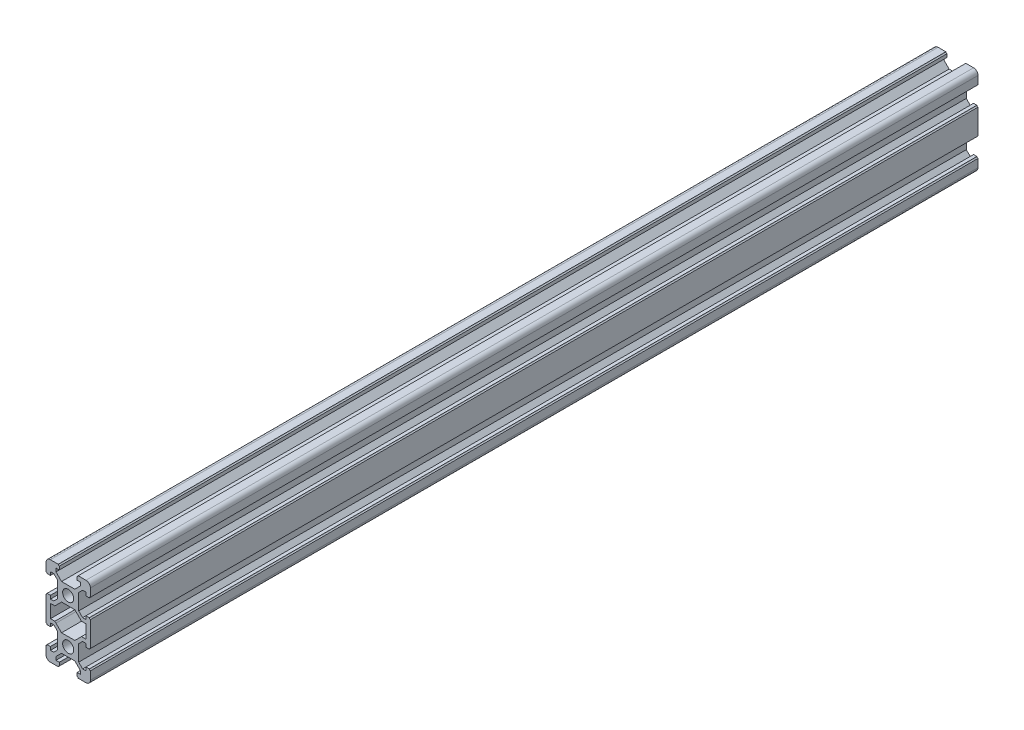
from build123d import *
from build123d.topology import SkipClean

# Parameters (mm, degrees)
EXTRUDE_1_DEPTH       = 200
MIRROR_2_COPY_1_DEPTH = 200
MIRROR_2_COPY_2_DEPTH = 200
FILLET_1_R            = 2


with BuildPart() as part:
    # Эскиз1 → Бобышка-Вытянуть1 (new, symmetric)
    with BuildSketch(Plane.XY):
        with BuildLine():
            Line((3, 14), (0, 14))
            Line((0, 14), (0, 12.5))
            ThreePointArc((0, 12.5), (1.767766953, 11.767766953), (2.5, 10))
            ThreePointArc((2.5, 10), (1.767766953, 8.232233047), (0, 7.5))
            Line((0, 7.5), (0, 6))
            Line((0, 6), (3, 6))
            Line((3, 6), (5.5, 3.5))
            Line((5.5, 3.5), (5.991970664, 3))
            Line((5.991970664, 3), (8, 3))
            Line((8, 3), (8, 0))
            Line((8, 0), (10, 0))
            Line((10, 0), (10, 5.641940268))
            ThreePointArc((10, 5.641940268), (9.646446609, 5.788386877), (9.5, 6.141940268))
            Line((9.5, 6.141940268), (8, 6.141940268))
            Line((8, 6.141940268), (8, 4.641940268))
            Line((8, 4.641940268), (6.5, 4.641940268))
            Line((6.5, 4.641940268), (4.740462433, 6.401477835))
            Line((4.740462433, 6.401477835), (4.740462433, 13.598522165))
            Line((4.740462433, 13.598522165), (6.5, 15.358059732))
            Line((6.5, 15.358059732), (8, 15.358059732))
            Line((8, 15.358059732), (8, 13.858059732))
            Line((8, 13.858059732), (9.5, 13.858059732))
            ThreePointArc((9.5, 13.858059732), (9.646446609, 14.211613123), (10, 14.358059732))
            Line((10, 14.358059732), (10, 20))
            Line((10, 20), (4.5, 20))
            ThreePointArc((4.5, 20), (4.353553391, 19.646446609), (4, 19.5))
            Line((4, 19.5), (4, 18))
            Line((4, 18), (5.5, 18))
            Line((5.5, 18), (5.5, 16.5))
            Line((5.5, 16.5), (3, 14))
        make_face()
    extrude_1 = extrude(amount=EXTRUDE_1_DEPTH, both=True)

    # Зеркальное отражение1: Бобышка-Вытянуть1 across plane
    with SkipClean():  # the faces are left unmerged after this step: merging them gives an invalid solid
        add(extrude_1.mirror(Plane(origin=(0, 0, 0), x_dir=(0, 0, 1), z_dir=(1, 0, 0))))

    # Зеркальное отражение2 copy 1 sketch → Зеркальное отражение2 copy 1 (add, symmetric)
    with SkipClean():  # the faces are left unmerged after this step: merging them gives an invalid solid
        with BuildSketch(Plane(origin=(0, 0, 0), x_dir=(-1, 0, 0), z_dir=(0, 0, 1))):
            with BuildLine():
                Line((3, 14), (0, 14))
                Line((0, 14), (0, 12.5))
                ThreePointArc((0, 12.5), (1.767766953, 11.767766953), (2.5, 10))
                ThreePointArc((2.5, 10), (1.767766953, 8.232233047), (0, 7.5))
                Line((0, 7.5), (0, 6))
                Line((0, 6), (3, 6))
                Line((3, 6), (5.5, 3.5))
                Line((5.5, 3.5), (5.991970664, 3))
                Line((5.991970664, 3), (8, 3))
                Line((8, 3), (8, 0))
                Line((8, 0), (10, 0))
                Line((10, 0), (10, 5.641940268))
                ThreePointArc((10, 5.641940268), (9.646446609, 5.788386877), (9.5, 6.141940268))
                Line((9.5, 6.141940268), (8, 6.141940268))
                Line((8, 6.141940268), (8, 4.641940268))
                Line((8, 4.641940268), (6.5, 4.641940268))
                Line((6.5, 4.641940268), (4.740462433, 6.401477835))
                Line((4.740462433, 6.401477835), (4.740462433, 13.598522165))
                Line((4.740462433, 13.598522165), (6.5, 15.358059732))
                Line((6.5, 15.358059732), (8, 15.358059732))
                Line((8, 15.358059732), (8, 13.858059732))
                Line((8, 13.858059732), (9.5, 13.858059732))
                ThreePointArc((9.5, 13.858059732), (9.646446609, 14.211613123), (10, 14.358059732))
                Line((10, 14.358059732), (10, 20))
                Line((10, 20), (4.5, 20))
                ThreePointArc((4.5, 20), (4.353553391, 19.646446609), (4, 19.5))
                Line((4, 19.5), (4, 18))
                Line((4, 18), (5.5, 18))
                Line((5.5, 18), (5.5, 16.5))
                Line((5.5, 16.5), (3, 14))
            make_face()
        extrude(amount=MIRROR_2_COPY_1_DEPTH, both=True)

    # Зеркальное отражение2 copy 2 sketch → Зеркальное отражение2 copy 2 (add, symmetric)
    with SkipClean():  # the faces are left unmerged after this step: merging them gives an invalid solid
        with BuildSketch(Plane.XY):
            with BuildLine():
                Line((3, -14), (0, -14))
                Line((0, -14), (0, -12.5))
                ThreePointArc((0, -12.5), (1.767766953, -11.767766953), (2.5, -10))
                ThreePointArc((2.5, -10), (1.767766953, -8.232233047), (0, -7.5))
                Line((0, -7.5), (0, -6))
                Line((0, -6), (3, -6))
                Line((3, -6), (5.5, -3.5))
                Line((5.5, -3.5), (5.991970664, -3))
                Line((5.991970664, -3), (8, -3))
                Line((8, -3), (8, 0))
                Line((8, 0), (10, 0))
                Line((10, 0), (10, -5.641940268))
                ThreePointArc((10, -5.641940268), (9.646446609, -5.788386877), (9.5, -6.141940268))
                Line((9.5, -6.141940268), (8, -6.141940268))
                Line((8, -6.141940268), (8, -4.641940268))
                Line((8, -4.641940268), (6.5, -4.641940268))
                Line((6.5, -4.641940268), (4.740462433, -6.401477835))
                Line((4.740462433, -6.401477835), (4.740462433, -13.598522165))
                Line((4.740462433, -13.598522165), (6.5, -15.358059732))
                Line((6.5, -15.358059732), (8, -15.358059732))
                Line((8, -15.358059732), (8, -13.858059732))
                Line((8, -13.858059732), (9.5, -13.858059732))
                ThreePointArc((9.5, -13.858059732), (9.646446609, -14.211613123), (10, -14.358059732))
                Line((10, -14.358059732), (10, -20))
                Line((10, -20), (4.5, -20))
                ThreePointArc((4.5, -20), (4.353553391, -19.646446609), (4, -19.5))
                Line((4, -19.5), (4, -18))
                Line((4, -18), (5.5, -18))
                Line((5.5, -18), (5.5, -16.5))
                Line((5.5, -16.5), (3, -14))
            make_face()
        extrude(amount=MIRROR_2_COPY_2_DEPTH, both=True)

    # Скругление1
    fillet_1_edges = [part.edges().sort_by_distance(p)[0] for p in [
        (-10, -20, 0),
        (10, -20, 0),
        (10, 20, 0),
        (-10, 20, 0),
    ]]
    fillet(fillet_1_edges, radius=FILLET_1_R)


solid = part.part
